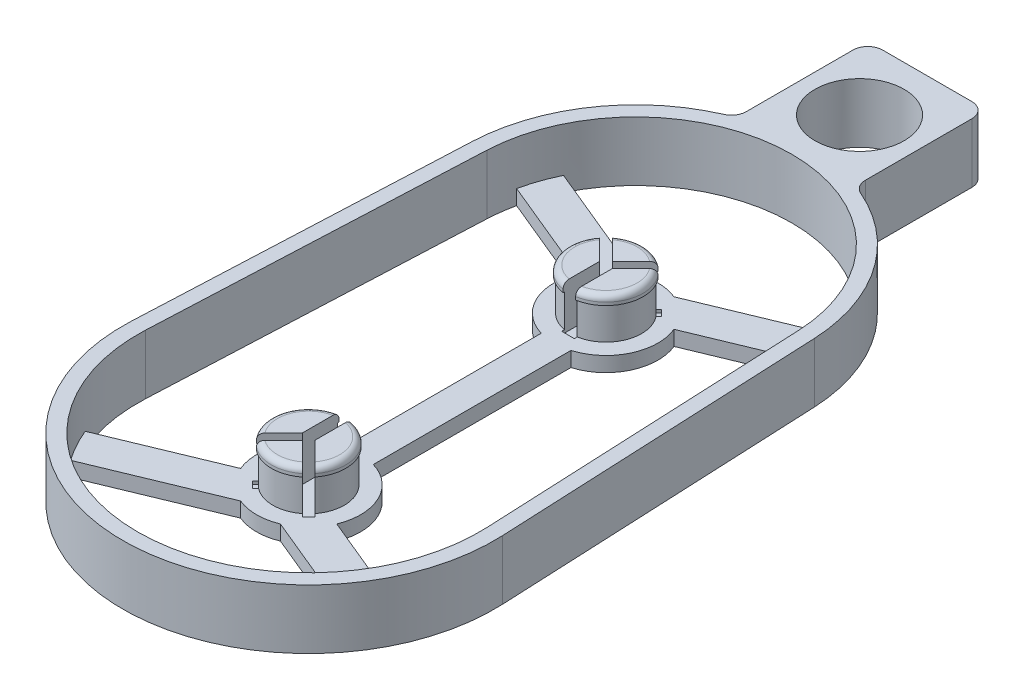
from build123d import *

# Parameters (mm, degrees)
SALIENTE_EXTRUIR1_DEPTH = 20
SALIENTE_EXTRUIR2_DEPTH = 5
SKETCH1_R               = 12
BOSS_EXTRUDE1_DEPTH     = 11
SKETCH2_R               = 12.5
BOSS_EXTRUDE2_DEPTH     = 3
FILLET1_R               = 2
CUT_EXTRUDE2_DEPTH      = 15
SKETCH7_R               = 15
CUT_EXTRUDE3_DEPTH      = 28


with BuildPart() as part:
    # Croquis1 → Saliente-Extruir1 (new body)
    with BuildSketch(Plane(origin=(0, 0, 0), x_dir=(1, 0, 0), z_dir=(0, 1, 0))):
        with BuildLine():
            Line((-57.44056846, 112.613636364), (-62.4354005, 2.840909091))
            ThreePointArc((-62.4354005, 2.840909091), (0, -62.5), (62.4354005, 2.840909091))
            Line((62.4354005, 2.840909091), (57.44056846, 112.613636364))
            ThreePointArc((57.44056846, 112.613636364), (47.362244362, 142.604720655), (22.943989921, 162.724029877))
            ThreePointArc((22.943989921, 162.724029877), (20.757274923, 164.567893199), (19.93911948, 167.308728127))
            Line((19.93911948, 167.308728127), (19.93911948, 203.118676651))
            ThreePointArc((19.93911948, 203.118676651), (18.474653385, 206.654210557), (14.93911948, 208.118676651))
            Line((14.93911948, 208.118676651), (-15.06088052, 208.118676651))
            ThreePointArc((-15.06088052, 208.118676651), (-18.596414426, 206.654210557), (-20.06088052, 203.118676651))
            Line((-20.06088052, 203.118676651), (-20.06088052, 167.255587217))
            ThreePointArc((-20.06088052, 167.255587217), (-20.876125318, 164.519198375), (-23.056010079, 162.675140239))
            ThreePointArc((-23.056010079, 162.675140239), (-47.396870484, 142.554364812), (-57.44056846, 112.613636364))
        make_face()
        with BuildLine():
            Line((-52.44573642, 112.386363636), (-57.44056846, 2.613636364))
            ThreePointArc((-57.44056846, 2.613636364), (0, -57.5), (57.44056846, 2.613636364))
            Line((57.44056846, 2.613636364), (52.44573642, 112.386363636))
            ThreePointArc((52.44573642, 112.386363636), (0, 162.5), (-52.44573642, 112.386363636))
        make_face(mode=Mode.SUBTRACT)
    extrude(amount=SALIENTE_EXTRUIR1_DEPTH)



with BuildPart() as body_2:
    # Croquis2 → Saliente-Extruir2 (new body)
    with BuildSketch(Plane(origin=(0, 0, 0), x_dir=(-1, 0, 0), z_dir=(0, -1, 0))):
        with BuildLine():
            Line((5, 83.229490169), (5, 16.770509831))
            ThreePointArc((5, 16.770509831), (15.80191276, 7.519943692), (16.167891819, -6.696960066))
            Line((16.167891819, -6.696960066), (53.123073119, -22.004297361))
            ThreePointArc((53.123073119, -22.004297361), (50.429243253, -27.625014479), (47.142858448, -32.921131471))
            Line((47.142858448, -32.921131471), (6.696960066, -16.167891819))
            ThreePointArc((6.696960066, -16.167891819), (0, -17.5), (-6.696960066, -16.167891819))
            Line((-6.696960066, -16.167891819), (-47.142858448, -32.921131471))
            ThreePointArc((-47.142858448, -32.921131471), (-50.429243253, -27.625014479), (-53.123073119, -22.004297361))
            Line((-53.123073119, -22.004297361), (-16.167891819, -6.696960066))
            ThreePointArc((-16.167891819, -6.696960066), (-15.80191276, 7.519943692), (-5, 16.770509831))
            Line((-5, 16.770509831), (-5, 83.229490169))
            ThreePointArc((-5, 83.229490169), (-15.80191276, 92.480056308), (-16.167891819, 106.696960066))
            Line((-16.167891819, 106.696960066), (-51.282274043, 121.241813418))
            ThreePointArc((-51.282274043, 121.241813418), (-49.596532898, 127.217256589), (-47.217157465, 132.951907131))
            Line((-47.217157465, 132.951907131), (-6.696960066, 116.167891819))
            ThreePointArc((-6.696960066, 116.167891819), (0, 117.5), (6.696960066, 116.167891819))
            Line((6.696960066, 116.167891819), (47.217157465, 132.951907131))
            ThreePointArc((47.217157465, 132.951907131), (49.596532898, 127.217256589), (51.282274043, 121.241813418))
            Line((51.282274043, 121.241813418), (16.167891819, 106.696960066))
            ThreePointArc((16.167891819, 106.696960066), (15.80191276, 92.480056308), (5, 83.229490169))
        make_face()
    extrude(amount=-SALIENTE_EXTRUIR2_DEPTH)


with BuildPart() as part_1:
    add(part.part)

    add(body_2.part)  # Boss-Extrude1 merges body 2
    # Sketch1 → Boss-Extrude1 (add)
    with BuildSketch(Plane(origin=(0, 5, 0), x_dir=(1, 0, 0), z_dir=(0, 1, 0))):
        with Locations(Location((0, 100, 0), (0, 0, 90))):
            Circle(SKETCH1_R)
        with Locations(Location((0, 0, 0), (0, 0, 90))):
            Circle(SKETCH1_R)
    extrude(amount=BOSS_EXTRUDE1_DEPTH)

    # Sketch2 → Boss-Extrude2 (add)
    with BuildSketch(Plane(origin=(0, 16, 0), x_dir=(1, 0, 0), z_dir=(0, 1, 0))):
        with Locations(Location((0, 100, 0), (0, 0, 270))):
            Circle(SKETCH2_R)
        with Locations(Location((0, 0, 0), (0, 0, 270))):
            Circle(SKETCH2_R)
    extrude(amount=BOSS_EXTRUDE2_DEPTH)

    # Fillet1
    fillet1_edges = [part_1.edges().sort_by_distance(p)[0] for p in [
        (0, 19, -112.5),
        (0, 19, -12.5),
    ]]
    fillet(fillet1_edges, radius=FILLET1_R)

    # Sketch6 → Cut-Extrude2 (cut)
    with BuildSketch(Plane(origin=(0, 19, 0), x_dir=(1, 0, 0), z_dir=(0, 1, 0))):
        Polygon((-10.514481664, 108.393161321), (-2.121320344, 100), (-2.121320344, 87.230677616), (2.121320344, 87.230677616), (2.121320344, 100), (10.425393612, 108.304073268), (8.270497601, 110.391817945), (0, 102.121320344), (-8.354488758, 110.475809101), align=None)
        Polygon((-2.121320344, 12.769322384), (2.121320344, 12.769322384), (2.121320344, 0), (10.425393612, -8.304073268), (8.270497601, -10.391817945), (0, -2.121320344), (-8.354488758, -10.475809101), (-10.514481664, -8.393161321), (-2.121320344, 0), align=None)
    extrude(amount=-CUT_EXTRUDE2_DEPTH, mode=Mode.SUBTRACT)

    # Sketch7 → Cut-Extrude3 (cut)
    with BuildSketch(Plane(origin=(0, 20, 0), x_dir=(1, 0, 0), z_dir=(0, 1, 0))):
        with Locations(Location((-0.03044026, 185.309338326, 0), (0, 0, 270))):
            Circle(SKETCH7_R)
    extrude(amount=-CUT_EXTRUDE3_DEPTH, mode=Mode.SUBTRACT)


solid = part_1.part
